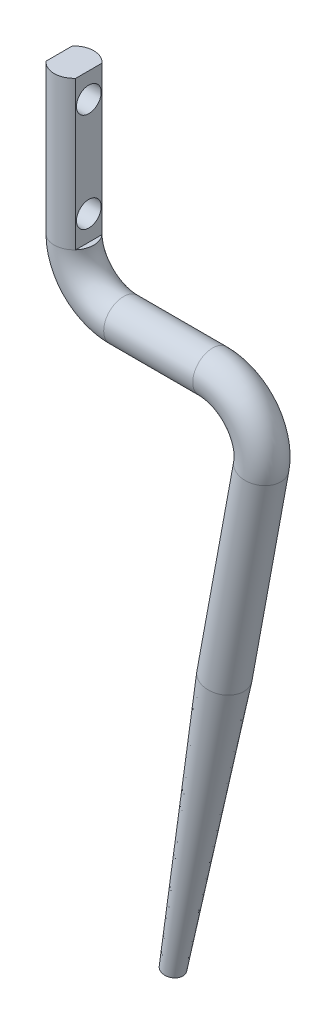
from build123d import *

# Parameters (mm, degrees)
SKETCH3_R             = 4
CHAMFER1_SIZE         = 2
CHAMFER1_SIZE2        = 57.272506566
SKETCH4_OUTSIDE_W     = 79.19
SKETCH4_OUTSIDE_H     = 41.202
SKETCH4_OUTSIDE_W_2   = 6
SKETCH4_OUTSIDE_H_2   = 35.530215116
EXTRUDE1_DEPTH        = 30
M6_TAPPED_HOLE1_D     = 5
M6_TAPPED_HOLE1_DEPTH = 9
M6_TAPPED_HOLE1_TIP   = 1.502151548


with BuildPart() as part:
    # Sweep1: sweep along a path in Sketch1
    with BuildLine(Plane.XY) as sweep1_path:
        Line((0, 40), (0, 10))
        ThreePointArc((0, 10), (2.928932188, 2.928932188), (10, 0))
        Line((10, 0), (27.98821011, 0))
        ThreePointArc((27.98821011, 0), (35.673513538, -3.601866584), (37.822529446, -11.812777758))
        Line((37.822529446, -11.812777758), (20, -108.5))
    # Sketch3 → Sweep1 (sweep)
    with BuildSketch(Plane(origin=(0, 40, 0), x_dir=(1, 0, 0), z_dir=(0, 1, 0))):
        Circle(SKETCH3_R)
    sweep(path=sweep1_path.line)

    # Chamfer1
    chamfer1_edges = [part.edges().sort_by_distance(p)[0] for p in [
        (16.066272266, -107.774888897, 0),
    ]]
    chamfer1_side = [part.faces().sort_by_distance(p)[0] for p in [
        (20, -108.5, 0),
    ]]
    chamfer(chamfer1_edges, length=CHAMFER1_SIZE, length2=CHAMFER1_SIZE2, reference=chamfer1_side[0])

    # Sketch4 outside → Extrude1 (cut)
    with BuildSketch(Plane(origin=(0, 40, 0), x_dir=(1, 0, 0), z_dir=(0, 1, 0))):
        with Locations((18.994, 0)):
            Rectangle(SKETCH4_OUTSIDE_W, SKETCH4_OUTSIDE_H)
        Rectangle(SKETCH4_OUTSIDE_W_2, SKETCH4_OUTSIDE_H_2, mode=Mode.SUBTRACT)
    extrude(amount=-EXTRUDE1_DEPTH, mode=Mode.SUBTRACT)

    # M6 Tapped Hole1
    with Locations(Plane(origin=(3, 0, 0), x_dir=(0, 0, -1), z_dir=(1, 0, 0))):
        with Locations((0, 35), (0, 15)):
            Hole(M6_TAPPED_HOLE1_D / 2, depth=M6_TAPPED_HOLE1_DEPTH)
            with Locations((0, 0, -(M6_TAPPED_HOLE1_DEPTH + M6_TAPPED_HOLE1_TIP / 2))):  # 118° drill point
                Cone(0, M6_TAPPED_HOLE1_D / 2, M6_TAPPED_HOLE1_TIP, mode=Mode.SUBTRACT)


solid = part.part
